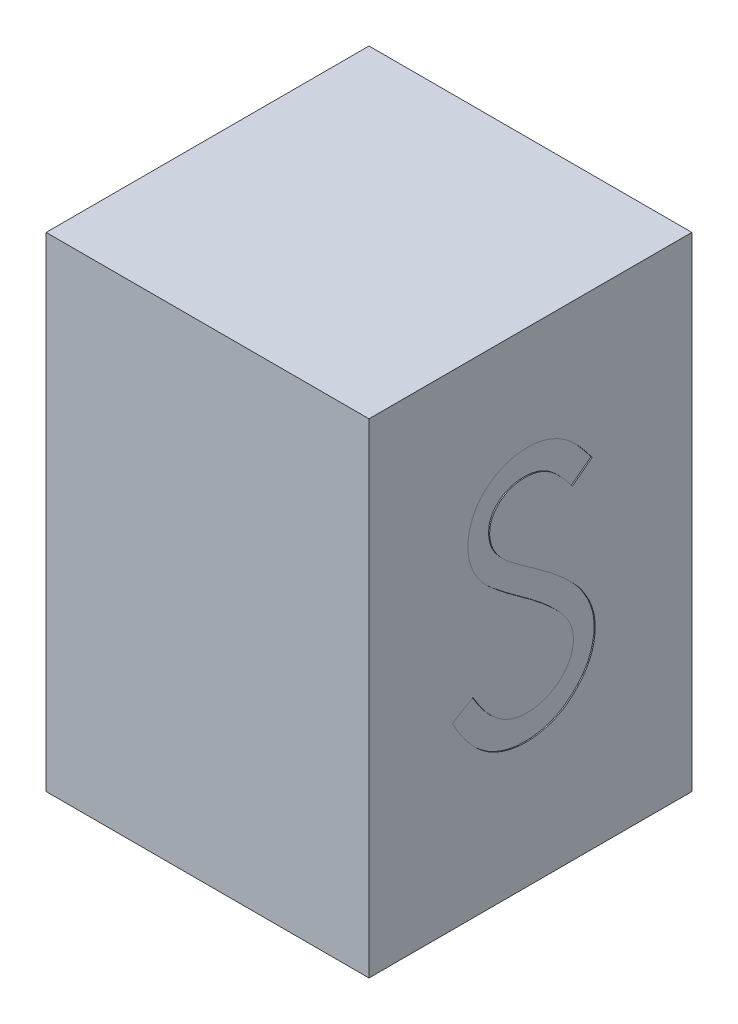
from build123d import *

# Parameters (mm, degrees)
SKETCH1_W           = 76.2
SKETCH1_H           = 76.2
BOSS_EXTRUDE1_DEPTH = 114.3
CUT_EXTRUDE1_DEPTH  = 0.254


with BuildPart() as part:
    # Sketch1 → Boss-Extrude1 (new body)
    with BuildSketch(Plane(origin=(0, 0, 0), x_dir=(1, 0, 0), z_dir=(0, 1, 0))):
        with Locations((38.1, -38.1)):
            Rectangle(SKETCH1_W, SKETCH1_H)
    extrude(amount=BOSS_EXTRUDE1_DEPTH)

    # Sketch2 → Cut-Extrude1 (cut)
    with BuildSketch(Plane(origin=(76.2, 0, 0), x_dir=(0, 0, -1), z_dir=(1, 0, 0))):
        with BuildLine():
            Line((-56.518128947, 42.162735797), (-51.686939044, 45.059160076))
            add(Edge.make_bspline(
                [(-51.686939044, 45.059160076), (-51.237605541, 44.306994476), (-50.37669989, 42.865874213), (-48.94057984, 40.918560781), (-47.452509591, 39.263461564), (-45.901469473, 37.910204958), (-44.29692692, 36.84478385), (-42.6284073, 36.09036741), (-40.901533333, 35.619843698), (-39.726303648, 35.562692284), (-39.139583274, 35.534160076)],
                knots=[0, 0, 0, 0, 1.272034388, 2.437168799, 3.508375237, 4.49857839, 5.41946034, 6.295179144, 7.148887113, 8, 8, 8, 8], degree=3))
            add(Edge.make_bspline(
                [(-39.139583274, 35.534160076), (-38.638510681, 35.548115657), (-37.645133086, 35.575782629), (-36.182709605, 35.841624868), (-34.762421034, 36.250037202), (-33.413539992, 36.834941841), (-32.154678743, 37.5425974), (-31.050757989, 38.397335699), (-30.096416456, 39.354291315), (-29.315761913, 40.421896662), (-28.716829337, 41.570075245), (-28.256493134, 42.748605422), (-28.001031432, 43.976000758), (-27.962549015, 44.802397316), (-27.943128947, 45.219436518)],
                knots=[0, 0, 0, 0, 1.095163259, 2.171163733, 3.241058638, 4.321873601, 5.38011039, 6.391990106, 7.366004449, 8.327778327, 9.272591725, 10.192022065, 11.087607919, 12, 12, 12, 12], degree=3))
            add(Edge.make_bspline(
                [(-27.943128947, 45.219436518), (-27.967202335, 45.695264964), (-28.016140014, 46.662554662), (-28.429766896, 48.089666138), (-29.080448169, 49.501966246), (-29.680729623, 50.375565483), (-29.992377746, 50.829111999)],
                knots=[0, 0, 0, 0, 0.938893495, 1.908633276, 2.914225137, 4, 4, 4, 4], degree=3))
            add(Edge.make_bspline(
                [(-29.992377746, 50.829111999), (-30.248256489, 51.15644799), (-30.785441902, 51.843648958), (-31.708945287, 52.86655616), (-32.792609125, 53.921682629), (-33.9993486, 55.049318374), (-35.37312175, 56.197017682), (-36.870901021, 57.419509706), (-38.530926604, 58.670304029), (-39.695145527, 59.509144635), (-40.295863322, 59.941972576)],
                knots=[0, 0, 0, 0, 0.722233717, 1.516239348, 2.393582979, 3.351407094, 4.387010283, 5.505090956, 6.712668013, 8, 8, 8, 8], degree=3))
            add(Edge.make_bspline(
                [(-40.295863322, 59.941972576), (-40.897146574, 60.370247942), (-42.046754365, 61.18907783), (-43.654442359, 62.404320067), (-45.092082663, 63.515379251), (-46.353285461, 64.532714763), (-47.437496021, 65.456464581), (-48.353258004, 66.277758073), (-49.0772433, 67.018806788), (-49.47983371, 67.499541839), (-49.66058688, 67.715380027)],
                knots=[0, 0, 0, 0, 1.452282411, 2.77665338, 3.964542531, 5.026858415, 5.96415736, 6.766646006, 7.446254459, 8, 8, 8, 8], degree=3))
            add(Edge.make_bspline(
                [(-49.66058688, 67.715380027), (-49.91323144, 68.051765529), (-50.410090874, 68.713312764), (-51.065944363, 69.747317227), (-51.623388121, 70.805788546), (-52.060378773, 71.891571021), (-52.428363032, 72.989421359), (-52.675870387, 74.113663843), (-52.830851339, 75.259253856), (-52.846722491, 76.030182873), (-52.854667409, 76.416101181)],
                knots=[0, 0, 0, 0, 1.068054152, 2.10047183, 3.106115577, 4.101338837, 5.06977816, 6.043150881, 7.020423561, 8, 8, 8, 8], degree=3))
            add(Edge.make_bspline(
                [(-52.854667409, 76.416101181), (-52.833355211, 77.0207445), (-52.791186347, 78.217107312), (-52.434561901, 79.964767872), (-51.871668795, 81.633326085), (-51.083082269, 83.20626282), (-50.066508635, 84.642621622), (-48.890100796, 85.958924702), (-47.488921814, 87.065488838), (-45.951543979, 88.032337163), (-44.268780647, 88.789099913), (-42.505443467, 89.359962775), (-40.658729848, 89.683419654), (-39.407910093, 89.729837944), (-38.773237121, 89.753390845)],
                knots=[0, 0, 0, 0, 1.005424448, 1.989358655, 2.955360095, 3.929531133, 4.905563448, 5.876582895, 6.856512386, 7.866279853, 8.892233794, 9.918561126, 10.94386622, 12, 12, 12, 12], degree=3))
            add(Edge.make_bspline(
                [(-38.773237121, 89.753390845), (-38.099779883, 89.730162609), (-36.760488382, 89.683969063), (-34.790459048, 89.282326516), (-32.893720493, 88.617742689), (-31.367925469, 87.863547888), (-30.17377195, 87.110287772), (-29.2630829, 86.42416407), (-28.340233668, 85.634267653), (-27.397780287, 84.738494535), (-26.451692091, 83.728625442), (-25.487923435, 82.611576622), (-24.504220588, 81.394174574), (-23.871392758, 80.525094512), (-23.546975101, 80.07956272)],
                knots=[0, 0, 0, 0, 1.286793592, 2.559021753, 3.825965368, 5.121522368, 5.803751409, 6.523245864, 7.299691795, 8.125521123, 9.008227632, 9.944561021, 10.946284179, 12, 12, 12, 12], degree=3))
            Line((-23.546975101, 80.07956272), (-28.183543611, 76.564929306))
            add(Edge.make_bspline(
                [(-28.183543611, 76.564929306), (-28.463512194, 76.925606066), (-29.002666226, 77.620185175), (-29.821209133, 78.592899657), (-30.592712055, 79.48144303), (-31.352813583, 80.253215049), (-32.061369594, 80.950479883), (-32.749080727, 81.547448484), (-33.406050205, 82.049969992), (-34.234184903, 82.586258407), (-35.274604218, 83.117859601), (-36.580637431, 83.56769669), (-37.945481893, 83.838017201), (-38.875061448, 83.873758608), (-39.345652986, 83.891852383)],
                knots=[0, 0, 0, 0, 1.181633172, 2.275549214, 3.290209073, 4.226197932, 5.078386478, 5.862611352, 6.581680152, 7.217281963, 8.414376989, 9.595101626, 10.782541182, 12, 12, 12, 12], degree=3))
            add(Edge.make_bspline(
                [(-39.345652986, 83.891852383), (-39.936037345, 83.872067054), (-41.074537965, 83.83391291), (-42.690907106, 83.417208008), (-44.145683625, 82.761095632), (-45.395677651, 81.841552489), (-46.436411434, 80.752093994), (-47.18924771, 79.498404975), (-47.642368254, 78.114029458), (-47.697661364, 77.148330699), (-47.725821255, 76.656515845)],
                knots=[0, 0, 0, 0, 1.14458467, 2.207223713, 3.21896685, 4.227309161, 5.202851033, 6.127160689, 7.046193047, 8, 8, 8, 8], degree=3))
            add(Edge.make_bspline(
                [(-47.725821255, 76.656515845), (-47.719402059, 76.350330988), (-47.70655317, 75.737460602), (-47.527350402, 74.832018098), (-47.297128502, 73.928862941), (-46.932305243, 73.032055625), (-46.4286455, 72.125912019), (-45.767253842, 71.194828504), (-44.934279332, 70.230598461), (-44.296207545, 69.603460915), (-43.959324861, 69.272351181)],
                knots=[0, 0, 0, 0, 0.858281714, 1.717966888, 2.583508476, 3.4729293, 4.427298488, 5.488583878, 6.674047936, 8, 8, 8, 8], degree=3))
            add(Edge.make_bspline(
                [(-43.959324861, 69.272351181), (-43.834225594, 69.160712317), (-43.537018372, 68.895483929), (-42.993670042, 68.461269976), (-42.276146922, 67.925647565), (-41.403185552, 67.262914669), (-40.358689917, 66.494141652), (-39.142545164, 65.629158242), (-37.768307564, 64.639884247), (-36.793133994, 63.948246119), (-36.277503947, 63.582537479)],
                knots=[0, 0, 0, 0, 0.420754252, 0.999615792, 1.744751191, 2.668019286, 3.750313428, 4.999500688, 6.413464383, 8, 8, 8, 8], degree=3))
            add(Edge.make_bspline(
                [(-36.277503947, 63.582537479), (-35.657248249, 63.131193566), (-34.456209054, 62.257228632), (-32.747300285, 60.944155456), (-31.197819961, 59.659949749), (-29.802327937, 58.412812536), (-28.547037846, 57.212203818), (-27.445876207, 56.043679316), (-26.487622884, 54.915610608), (-25.455996503, 53.469346979), (-24.401859535, 51.693107274), (-23.496578921, 49.516864036), (-22.925759048, 47.33216126), (-22.851112732, 45.863784488), (-22.814282794, 45.139298297)],
                knots=[0, 0, 0, 0, 1.163667725, 2.253281268, 3.268753668, 4.215851969, 5.092017293, 5.902905408, 6.650798638, 7.335211899, 8.59617414, 9.77448103, 10.901945474, 12, 12, 12, 12], degree=3))
            add(Edge.make_bspline(
                [(-22.814282794, 45.139298297), (-22.82501292, 44.626934421), (-22.846264802, 43.61215643), (-23.090555151, 42.122091389), (-23.44847197, 40.674875902), (-23.987922804, 39.288398738), (-24.646342374, 37.93729497), (-25.481814107, 36.657005967), (-26.450223874, 35.419195773), (-27.561118063, 34.25687105), (-28.776713297, 33.189861021), (-30.061505625, 32.240696489), (-31.417597939, 31.449278008), (-32.837633653, 30.803469259), (-34.321938951, 30.298369108), (-35.870014621, 29.932398974), (-37.484412497, 29.707787866), (-38.581700361, 29.684474561), (-39.139583274, 29.672621614)],
                knots=[0, 0, 0, 0, 0.983748083, 1.948392443, 2.894712957, 3.844097841, 4.80183111, 5.778335162, 6.776009319, 7.81870978, 8.863265674, 9.881300176, 10.883814829, 11.87499822, 12.874611388, 13.892143829, 14.928324115, 16, 16, 16, 16], degree=3))
            add(Edge.make_bspline(
                [(-39.139583274, 29.672621614), (-39.571234661, 29.680968479), (-40.429101228, 29.69755709), (-41.697986054, 29.844208568), (-42.941236774, 30.051697417), (-44.143252837, 30.38111116), (-45.319520858, 30.780785228), (-46.464924988, 31.272901144), (-47.580020339, 31.862643448), (-48.671056013, 32.536932207), (-49.735257178, 33.321646522), (-50.762642205, 34.235613757), (-51.786920191, 35.253626788), (-52.777858677, 36.403330701), (-53.75550159, 37.666151111), (-54.700573334, 39.053903063), (-55.632636239, 40.559027568), (-56.217451663, 41.618181754), (-56.518128947, 42.162735797)],
                knots=[0, 0, 0, 0, 0.915332311, 1.819136955, 2.706846663, 3.586547465, 4.459518054, 5.340707479, 6.227863349, 7.133153174, 8.059268498, 9.028702269, 10.047606654, 11.120612155, 12.245963614, 13.433783089, 14.680604001, 16, 16, 16, 16], degree=3))
        make_face()
    extrude(amount=-CUT_EXTRUDE1_DEPTH, mode=Mode.SUBTRACT)


solid = part.part
